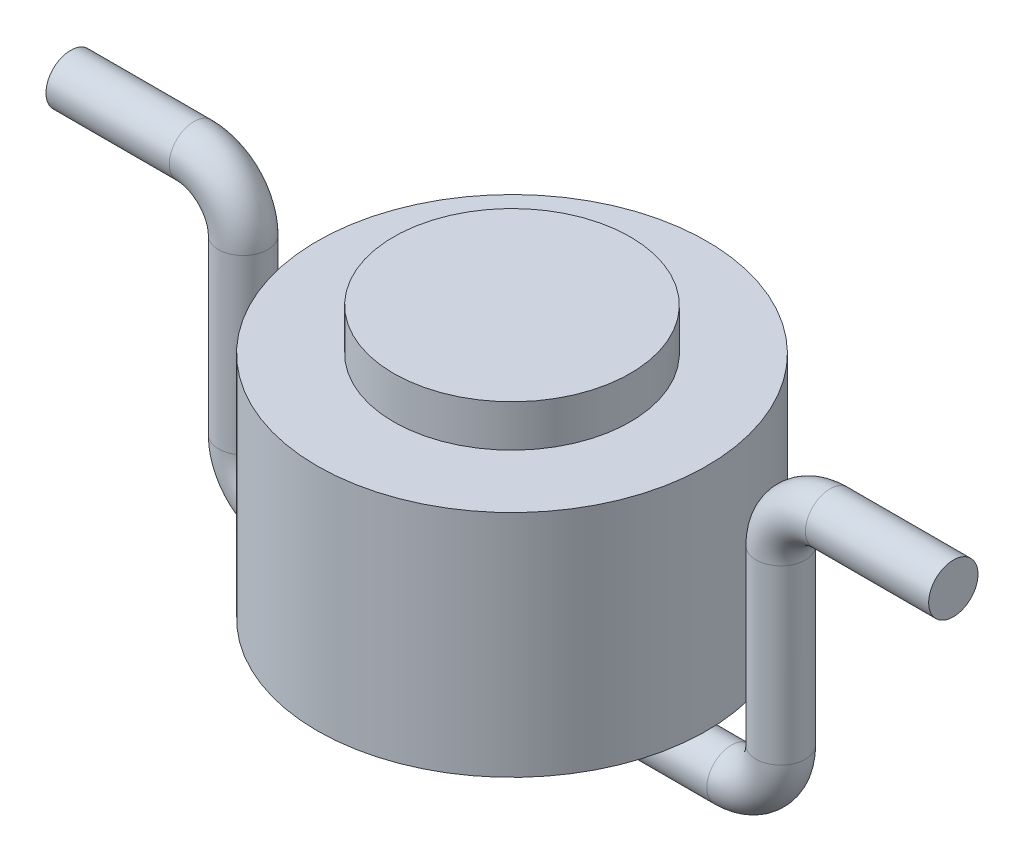
from build123d import *

# Parameters (mm, degrees)
SKETCH_1_R      = 3.95
SKETCH_1_R_2    = 2.4
EXTRUDE_1_DEPTH = 4.65
EXTRUDE_START   = 4.65
SKETCH_1_3_R    = 2.4
EXTRUDE_2_DEPTH = 0.85
SKETCH_3_R      = 0.5


with BuildPart() as part:
    # Эскиз1 → Бобышка-Вытянуть1 (new body)
    # profile 1 of 2: a face of its own
    with BuildSketch(Plane(origin=(0, 0, 0), x_dir=(1, 0, 0), z_dir=(0, 1, 0))):
        with Locations(Location((0, 0, 0), (0, 0, 270))):
            Circle(SKETCH_1_R)
        Circle(SKETCH_1_R_2, mode=Mode.SUBTRACT)
    # profile 2 of 2: a face of its own
    with BuildSketch(Plane(origin=(0, 0, 0), x_dir=(1, 0, 0), z_dir=(0, 1, 0))):
        Circle(SKETCH_1_R_2)
    extrude(amount=EXTRUDE_1_DEPTH)

    # Эскиз1<3> → Бобышка-Вытянуть2 (add)
    with BuildSketch(Plane(origin=(0, 0, 0), x_dir=(1, 0, 0), z_dir=(0, 1, 0)).offset(EXTRUDE_START)):
        with Locations(Location((0, 0, 0), (0, 0, 270))):
            Circle(SKETCH_1_3_R)
    extrude(amount=EXTRUDE_2_DEPTH)


with BuildPart() as body_2:
    # По траектории3: sweep along a path in Эскиз2
    with BuildLine(Plane.XY) as sweep_3_path:
        Line((-8.95, 5), (-6.45, 5))
        ThreePointArc((-6.45, 5), (-5.742893219, 4.707106781), (-5.45, 4))
        Line((-5.45, 4), (-5.45, 0.5))
        ThreePointArc((-5.45, 0.5), (-5.157106781, -0.207106781), (-4.45, -0.5))
        Line((-4.45, -0.5), (4.45, -0.5))
        ThreePointArc((4.45, -0.5), (5.157106781, -0.207106781), (5.45, 0.5))
        Line((5.45, 0.5), (5.45, 4))
        ThreePointArc((5.45, 4), (5.742893219, 4.707106781), (6.45, 5))
        Line((6.45, 5), (8.95, 5))
    # Эскиз3 → По траектории3 (sweep)
    with BuildSketch(Plane(origin=(-8.95, 0, 0), x_dir=(0, 0, -1), z_dir=(1, 0, 0))):
        with Locations((0, 5)):
            Circle(SKETCH_3_R)
    sweep(path=sweep_3_path.line)


solid = Compound([part.part, body_2.part])
